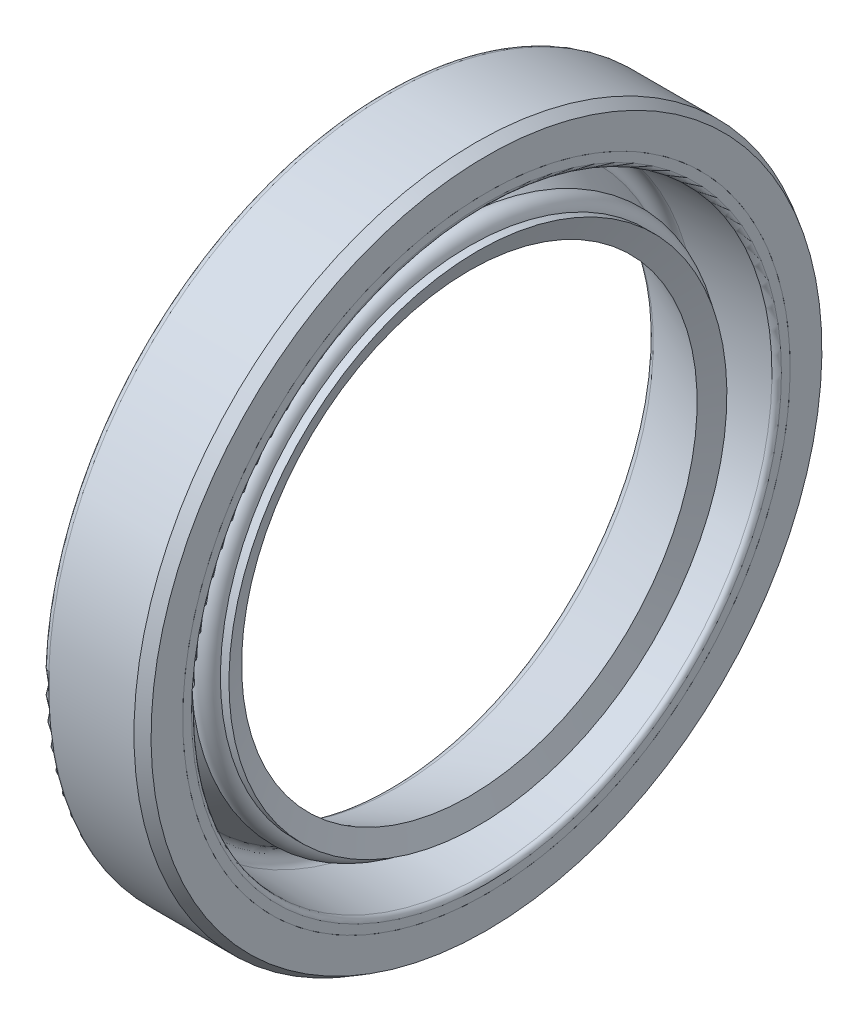
from build123d import *

# Parameters (mm, degrees)
SKETCH2_R = 1.787525


with BuildPart() as part:
    # Sketch1 → Revolve1 (revolve)
    with BuildSketch(Plane.XY):
        with BuildLine():
            Line((0, 46.7312375), (0, 42.333333333))
            Line((0, 42.333333333), (14.3002, 42.333333333))
            Line((14.3002, 42.333333333), (14.3002, 46.754226341))
            Line((14.3002, 46.754226341), (12.791975781, 47.625))
            Line((12.791975781, 47.625), (0.8937625, 47.625))
            ThreePointArc((0.8937625, 47.625), (0.261776975, 47.363223025), (0, 46.7312375))
        make_face()
    revolve(axis=Axis((14.3002, 0, 0), (-1, 0, 0)))


with BuildPart() as body_2:
    # Sketch1<3> → Revolve2 (revolve)
    with BuildSketch(Plane.XY):
        with BuildLine():
            ThreePointArc((0, 38.364583333), (0.458946142, 36.86441616), (1.678672315, 35.877805207))
            Line((1.678672315, 35.877805207), (11.916833333, 31.75))
            Line((11.916833333, 31.75), (13.108516667, 34.705722288))
            Line((13.108516667, 34.705722288), (11.916833333, 34.705722288))
            ThreePointArc((11.916833333, 34.705722288), (9.84822767, 32.739561023), (8.52552273, 35.268468129))
            Line((8.52552273, 35.268468129), (3.054073684, 37.861369317))
            ThreePointArc((3.054073684, 37.861369317), (2.407648607, 39.158866264), (3.51549063, 40.093772548))
            Line((3.51549063, 40.093772548), (13.653272021, 40.447791675))
            ThreePointArc((13.653272021, 40.447791675), (14.112067329, 40.652060507), (14.3002, 41.117705208))
            Line((14.3002, 41.117705208), (14.3002, 42.333333333))
            Line((14.3002, 42.333333333), (0, 42.333333333))
            Line((0, 42.333333333), (0, 38.364583333))
        make_face()
    revolve(axis=Axis((14.3002, 0, 0), (-1, 0, 0)))


with BuildPart() as body_3:
    # Sketch2 → Revolve3 (revolve)
    with BuildSketch(Plane.XY):
        with Locations((10.140843947, 34.50297287)):
            Circle(SKETCH2_R)
    revolve(axis=Axis((0, 0, 0), (1, 0, 0)))


solid = Compound([part.part, body_2.part, body_3.part])
